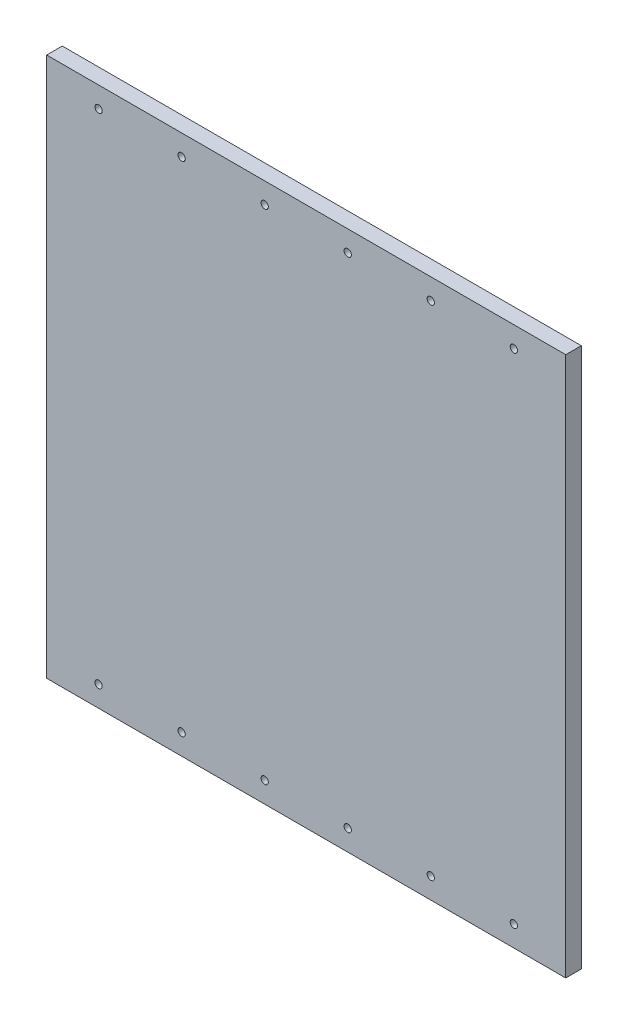
from build123d import *

# Parameters (mm, degrees)
ESQUISSE1_W             = 500
ESQUISSE1_H             = 520
BOSS_EXTRU_1_DEPTH      = 15
ESQUISSE2_R             = 3.5
ENL_V_MAT_EXTRU_1_DEPTH = 722.543484483


with BuildPart() as part:
    # Esquisse1 → Boss.-Extru.1 (new body)
    with BuildSketch(Plane.XY):
        with Locations((250, 260)):
            Rectangle(ESQUISSE1_W, ESQUISSE1_H)
    extrude(amount=BOSS_EXTRU_1_DEPTH)

    # Esquisse2 → Enlèv. mat.-Extru.1 (cut, through all)
    with BuildSketch(Plane.XY.offset(15)):
        with Locations((210, 500)):
            Circle(ESQUISSE2_R)
        with Locations(Location((290, 500, 0), (0, 0, 180))):
            Circle(ESQUISSE2_R)
        with Locations((130, 500)):
            Circle(ESQUISSE2_R)
        with Locations((50, 500)):
            Circle(ESQUISSE2_R)
        with Locations(Location((450, 500, 0), (0, 0, 180))):
            Circle(ESQUISSE2_R)
        with Locations(Location((370, 500, 0), (0, 0, 180))):
            Circle(ESQUISSE2_R)
        with Locations((370, 20)):
            Circle(ESQUISSE2_R)
        with Locations((450, 20)):
            Circle(ESQUISSE2_R)
        with Locations(Location((50, 20, 0), (0, 0, 180))):
            Circle(ESQUISSE2_R)
        with Locations(Location((130, 20, 0), (0, 0, 180))):
            Circle(ESQUISSE2_R)
        with Locations((290, 20)):
            Circle(ESQUISSE2_R)
        with Locations(Location((210, 20, 0), (0, 0, 180))):
            Circle(ESQUISSE2_R)
    extrude(amount=-ENL_V_MAT_EXTRU_1_DEPTH, mode=Mode.SUBTRACT)


solid = part.part
